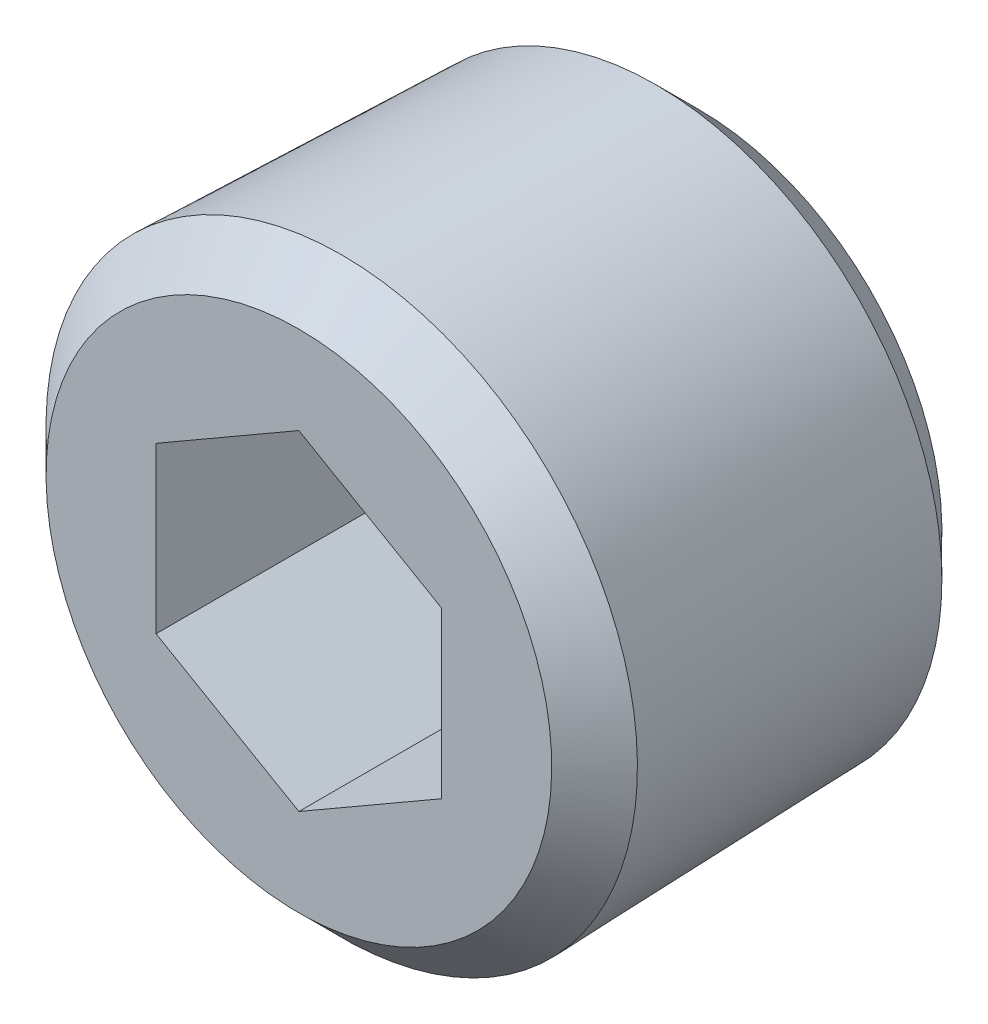
from build123d import *

# Parameters (mm, degrees)
CUT_EXTRUDE1_DEPTH = 10


with BuildPart() as part:
    # Sketch1 → Revolve1 (revolve)
    with BuildSketch(Plane(origin=(0, 0, 0), x_dir=(0, 0, -1), z_dir=(1, 0, 0))):
        Polygon((0, 0), (0, 8.506617168), (-1.5, 10.006617168), (-12.5, 10.35), (-14, 8.85), (-14, 0), align=None)
    revolve(axis=Axis((0, 0, 0), (0, 0, 1)))

    # Sketch2 → Cut-Extrude1 (cut)
    with BuildSketch(Plane.XY.offset(14)):
        Polygon((0, -5.773502692), (5, -2.886751346), (5, 2.886751346), (0, 5.773502692), (-5, 2.886751346), (-5, -2.886751346), align=None)
    extrude(amount=-CUT_EXTRUDE1_DEPTH, mode=Mode.SUBTRACT)


solid = part.part
